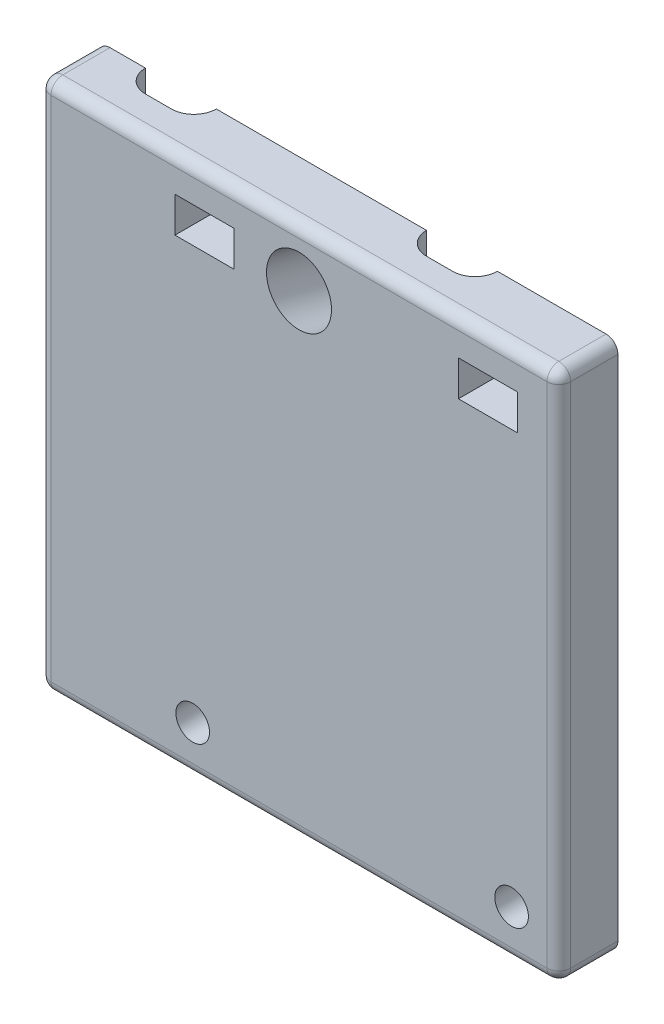
from build123d import *

# Parameters (mm, degrees)
SKETCH1_W                       = 44
SKETCH1_H                       = 45
BASE_DEPTH                      = 5
WIRE_GROOVES_DEPTH              = 51.338851795
SCREW_INSERTION_HOLE_DEPTH      = 33.181634738
SCREW_INSERTION_HOLE_DEPTH_BACK = 33.181634738
SKETCH3_R                       = 2.75
SKETCH5_W                       = 5
SKETCH5_H                       = 3
ZIP_TIE_SLOTS_DEPTH             = 32.862987933
SKETCH6_R                       = 1.425
MOUNT_CLAMPING_HOLES_DEPTH      = 32.862987933
EDGE_FILLETS_R                  = 1


with BuildPart() as part:
    # Sketch1 → Base (new body)
    with BuildSketch(Plane.XY):
        Rectangle(SKETCH1_W, SKETCH1_H)
    extrude(amount=BASE_DEPTH)

    # Sketch2 → Wire Grooves (cut, through all)
    with BuildSketch(Plane(origin=(0, 22.5, 0), x_dir=(1, 0, 0), z_dir=(0, 1, 0))):
        with BuildLine():
            Line((-18, 0), (-12, 0))
            ThreePointArc((-12, 0), (-12.556497116, -1.343502884), (-13.9, -1.9))
            Line((-13.9, -1.9), (-16.1, -1.9))
            ThreePointArc((-16.1, -1.9), (-17.443502884, -1.343502884), (-18, 0))
        make_face()
        with BuildLine():
            Line((9.9, -1.9), (7.7, -1.9))
            ThreePointArc((7.7, -1.9), (6.356497116, -1.343502884), (5.8, 0))
            Line((5.8, 0), (11.8, 0))
            ThreePointArc((11.8, 0), (11.243502884, -1.343502884), (9.9, -1.9))
        make_face()
    extrude(amount=-WIRE_GROOVES_DEPTH, mode=Mode.SUBTRACT)

    # Sketch3 → Screw Insertion Hole (cut, two sides: drawn at the far end of the back side and taken through both)
    with BuildSketch(Plane(origin=(0, 0.596130014, 4.269237963), x_dir=(-1, 0, 0), z_dir=(0, -0.25881904510252135, -0.9659258262890681)).offset(-SCREW_INSERTION_HOLE_DEPTH_BACK)):
        with Locations(Location((0, 16.291616808, 0), (0, 0, 270))):
            Circle(SKETCH3_R)
    extrude(amount=SCREW_INSERTION_HOLE_DEPTH + SCREW_INSERTION_HOLE_DEPTH_BACK, mode=Mode.SUBTRACT)

    # Sketch5 → Zip Tie Slots (cut, through all)
    with BuildSketch(Plane(origin=(0, 0, 0), x_dir=(-1, 0, 0), z_dir=(0, 0, -1))):
        with Locations((-16, 18)):
            Rectangle(SKETCH5_W, SKETCH5_H)
        with Locations((8, 18)):
            Rectangle(SKETCH5_W, SKETCH5_H)
    extrude(amount=-ZIP_TIE_SLOTS_DEPTH, mode=Mode.SUBTRACT)

    # Sketch6 → Mount Clamping Holes (cut, through all)
    with BuildSketch(Plane(origin=(0, 0, 0), x_dir=(-1, 0, 0), z_dir=(0, 0, -1))):
        with Locations((-18, -18.5)):
            Circle(SKETCH6_R)
        with Locations(Location((9, -18.5, 0), (0, 0, 180))):
            Circle(SKETCH6_R)
    extrude(amount=-MOUNT_CLAMPING_HOLES_DEPTH, mode=Mode.SUBTRACT)

    # Edge Fillets
    edge_fillets_edges = [part.edges().sort_by_distance(p)[0] for p in [
        (-22, 0, 5),
        (0, -22.5, 5),
        (22, 0, 5),
        (22, -22.5, 2.5),
        (-22, -22.5, 2.5),
        (-22, 22.5, 2.5),
        (22, 22.5, 2.5),
        (0, 22.5, 5),
    ]]
    fillet(edge_fillets_edges, radius=EDGE_FILLETS_R)


solid = part.part
